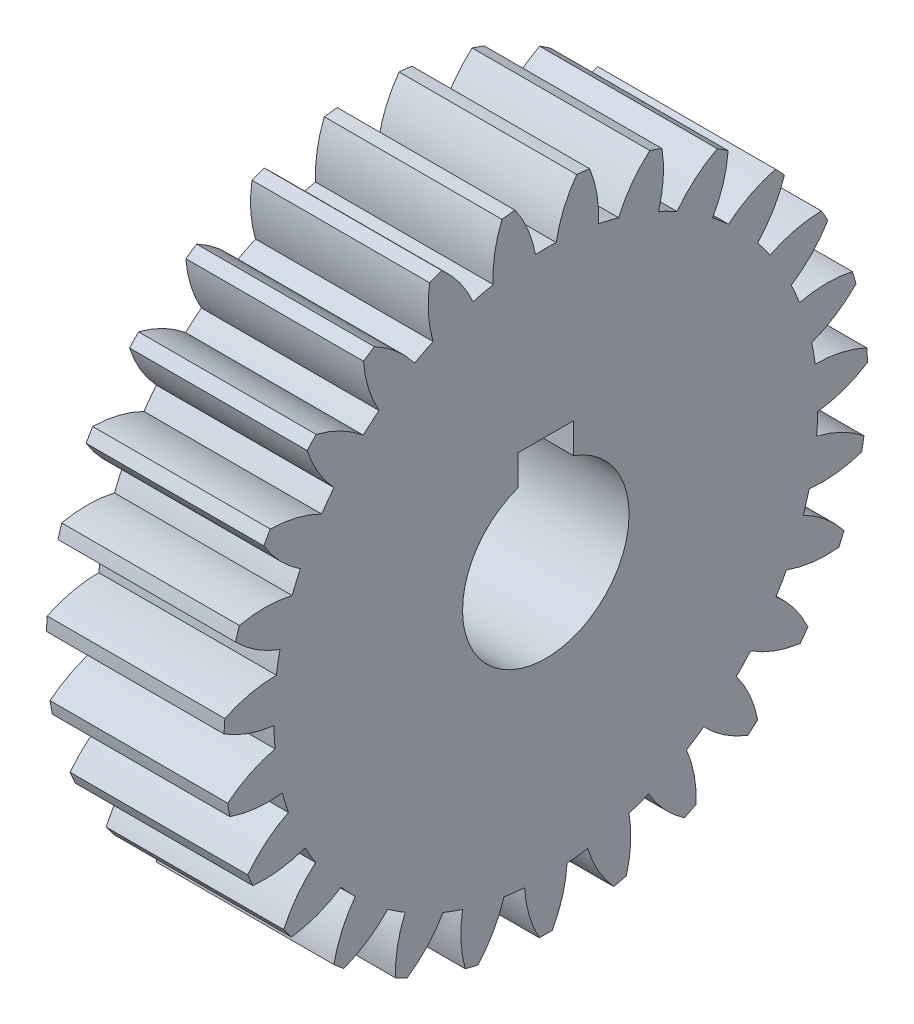
from build123d import *

# Parameters (mm, degrees)
BASPROSKE_W     = 16
BASPROSKE_H     = 29
TOOTHCUT_DEPTH  = 45.022721406
TEETHCUTS_COUNT = 27
TEETHCUTS_ANGLE = 346.666666667
BORSKE_R        = 7.5
BORE_DEPTH      = 50.0000508
KEYSKE_W        = 5
KEYSKE_H        = 9.8
KEYWAY_DEPTH    = 50.0000508


with BuildPart() as part:
    # BasProSke → Base-Revolve (revolve)
    with BuildSketch(Plane(origin=(0, 0, 0), x_dir=(1, 0, 0), z_dir=(0, 1, 0)), mode=Mode.PRIVATE) as base_revolve_sk:
        with Locations((8, 14.5)):
            Rectangle(BASPROSKE_W, BASPROSKE_H)
    revolve(base_revolve_sk.sketch.rotate(Axis((-10, 0, 0), (1, 0, 0)), 180), axis=Axis((-10, 0, 0), (1, 0, 0)))

    # TooCutSke → ToothCut (cut, through all)
    with BuildSketch(Plane(origin=(0, 0, 0), x_dir=(0, 0, -1), z_dir=(1, 0, 0))):
        with BuildLine():
            ThreePointArc((0.93398677, 24.48119012), (0, 24.499), (-0.93398677, 24.48119012))
            ThreePointArc((-0.93398677, 24.48119012), (-1.619264734, 26.790298527), (-2.799272507, 28.890100702))
            ThreePointArc((-2.799272507, 28.890100702), (0, 29.0254), (2.799272507, 28.890100702))
            ThreePointArc((2.799272507, 28.890100702), (1.619264734, 26.790298527), (0.93398677, 24.48119012))
        make_face()
    toothcut = extrude(amount=TOOTHCUT_DEPTH, mode=Mode.SUBTRACT)

    # TeethCuts: ToothCut ×27 about axis
    teethcuts_axis = Axis((-10, 0, 0), (1, 0, 0))
    for i in range(1, TEETHCUTS_COUNT):
        add(toothcut.rotate(teethcuts_axis, i * TEETHCUTS_ANGLE / (TEETHCUTS_COUNT - 1)), mode=Mode.SUBTRACT)

    # BorSke → Bore (cut, symmetric)
    with BuildSketch(Plane(origin=(0, 0, 0), x_dir=(0, 0, -1), z_dir=(1, 0, 0))):
        with Locations(Location((0, 0, 0), (0, 0, 180))):
            Circle(BORSKE_R)
    extrude(amount=BORE_DEPTH, both=True, mode=Mode.SUBTRACT)

    # KeySke → Keyway (cut, symmetric)
    with BuildSketch(Plane(origin=(0, 0, 0), x_dir=(0, 0, -1), z_dir=(1, 0, 0))):
        with Locations((0, 4.9)):
            Rectangle(KEYSKE_W, KEYSKE_H)
    extrude(amount=KEYWAY_DEPTH, both=True, mode=Mode.SUBTRACT)


solid = part.part
